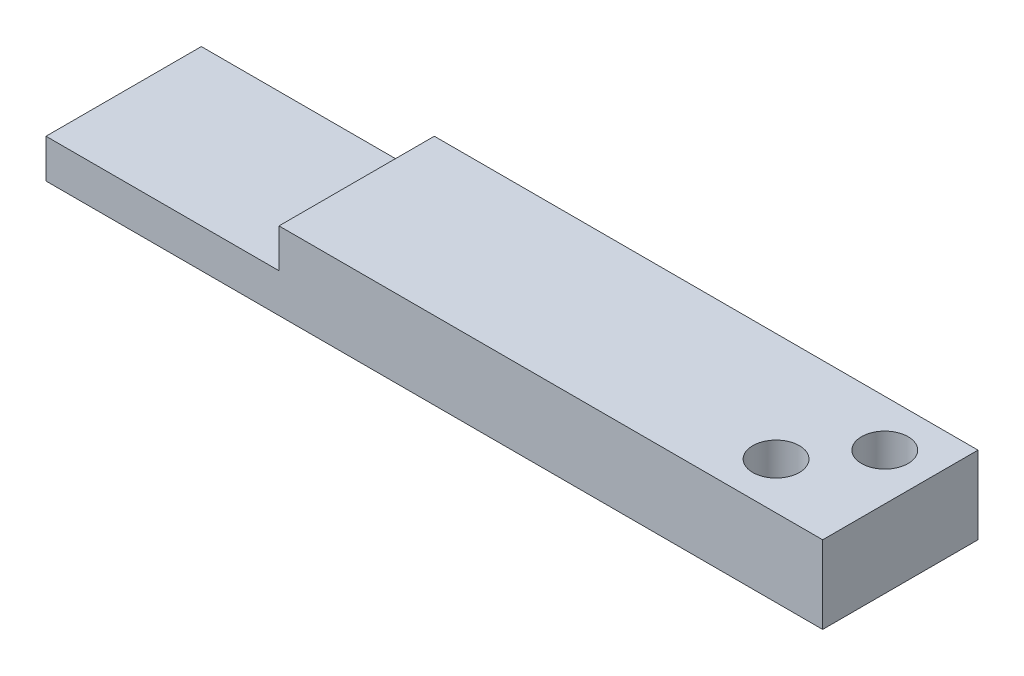
from build123d import *

# Parameters (mm, degrees)
SKETCH_1_W          = 50
SKETCH_1_H          = 10
EXTRUDE_1_DEPTH     = 5
SKETCH_2_R          = 1.5
CUT_EXTRUDE_1_DEPTH = 26.980762114
SKETCH_3_W          = 15
SKETCH_3_H          = 2.5
CUT_EXTRUDE_2_DEPTH = 28.386127875


with BuildPart() as part:
    # 草图1 → 凸台-拉伸1 (new body)
    with BuildSketch(Plane(origin=(0, 0, 0), x_dir=(1, 0, 0), z_dir=(0, 1, 0))):
        Rectangle(SKETCH_1_W, SKETCH_1_H)
    extrude(amount=EXTRUDE_1_DEPTH)

    # 草图2 → 切除-拉伸1 (cut, through all)
    with BuildSketch(Plane(origin=(0, 5, 0), x_dir=(1, 0, 0), z_dir=(0, 1, 0))):
        with Locations(Location((22, 2, 0), (0, 0, 270))):
            Circle(SKETCH_2_R)
        with Locations(Location((19, -2, 0), (0, 0, 270))):
            Circle(SKETCH_2_R)
    extrude(amount=-CUT_EXTRUDE_1_DEPTH, mode=Mode.SUBTRACT)

    # 草图3 → 切除-拉伸2 (cut, through all)
    with BuildSketch(Plane.XY.offset(5)):
        with Locations((-17.5, 3.75)):
            Rectangle(SKETCH_3_W, SKETCH_3_H)
    extrude(amount=-CUT_EXTRUDE_2_DEPTH, mode=Mode.SUBTRACT)


solid = part.part
